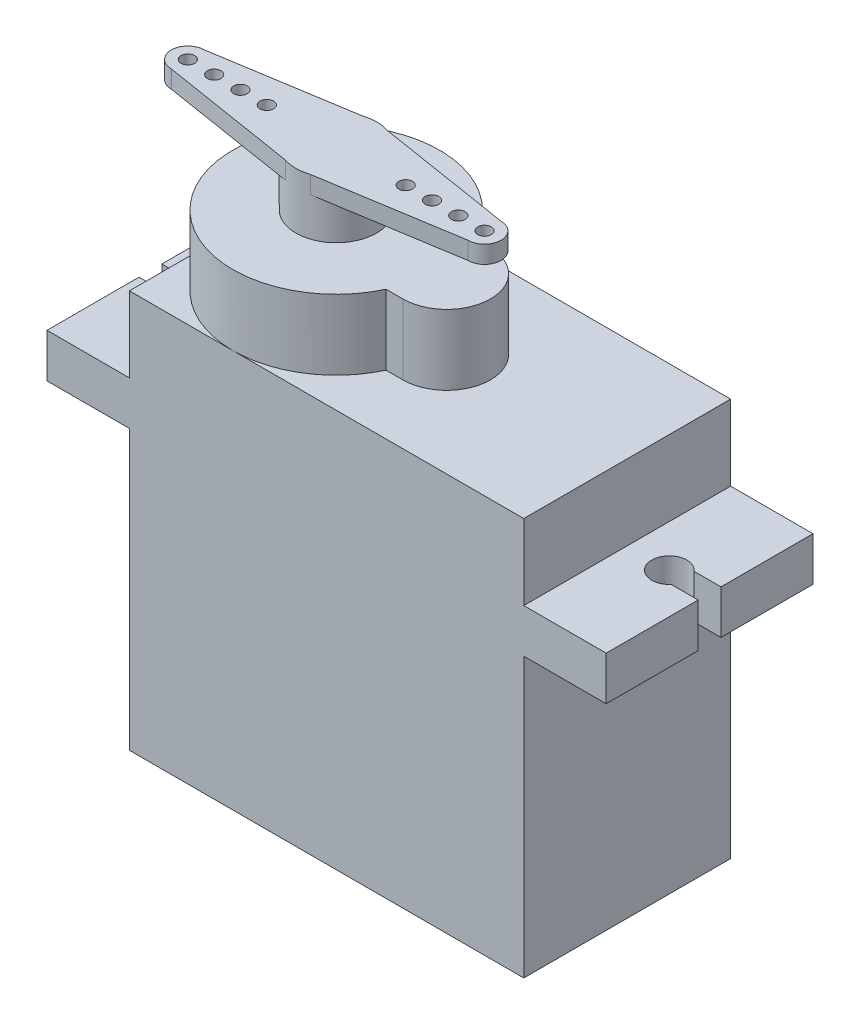
from build123d import *

# Parameters (mm, degrees)
SALIENTE_EXTRUIR1_DEPTH = 11.8
CROQUIS2_R              = 2.3
SALIENTE_EXTRUIR2_DEPTH = 4
CROQUIS3_R              = 2.3
SALIENTE_EXTRUIR3_DEPTH = 7.2
CORTAR_EXTRUIR1_DEPTH   = 7.2
CROQUIS5_R              = 0.38741291
SALIENTE_EXTRUIR4_DEPTH = 1


with BuildPart() as part:
    # Croquis1 → Saliente-Extruir1 (new body)
    with BuildSketch(Plane.XY):
        Polygon((-10.840013315, -12.513302196), (11.659986685, -12.513302196), (11.659986685, 3.386697804), (16.359986685, 3.386697804), (16.359986685, 5.886697804), (11.659986685, 5.886697804), (11.659986685, 10.186697804), (-10.840013315, 10.186697804), (-10.840013315, 5.886697804), (-15.540013315, 5.886697804), (-15.540013315, 3.386697804), (-10.840013315, 3.386697804), align=None)
    extrude(amount=SALIENTE_EXTRUIR1_DEPTH)

    # Croquis2 → Saliente-Extruir2 (add)
    with BuildSketch(Plane(origin=(0, 10.186697804, 0), x_dir=(1, 0, 0), z_dir=(0, 1, 0))):
        with BuildLine():
            Line((1.359986685, -3.4), (0.404142371, -3.4))
            ThreePointArc((0.404142371, -3.4), (-10.840013315, -5.9), (0.404142371, -8.4))
            Line((0.404142371, -8.4), (1.359986685, -8.4))
            ThreePointArc((1.359986685, -8.4), (3.859986685, -5.9), (1.359986685, -3.4))
        make_face()
        with Locations(Location((-4.940013315, -5.9, 0), (0, 0, 270))):
            Circle(CROQUIS2_R, mode=Mode.SUBTRACT)
    extrude(amount=SALIENTE_EXTRUIR2_DEPTH)

    # Croquis3 → Saliente-Extruir3 (add)
    with BuildSketch(Plane(origin=(0, 10.186697804, 0), x_dir=(1, 0, 0), z_dir=(0, 1, 0))):
        with Locations(Location((-4.940013315, -5.9, 0), (0, 0, 270))):
            Circle(CROQUIS3_R)
    extrude(amount=SALIENTE_EXTRUIR3_DEPTH)

    # Croquis4 → Cortar-Extruir1 (cut)
    with BuildSketch(Plane(origin=(0, 5.886697804, 0), x_dir=(1, 0, 0), z_dir=(0, 1, 0))):
        with BuildLine():
            Line((16.359986685, -5.25), (16.359986685, -6.55))
            Line((16.359986685, -6.55), (14.819920893, -6.55))
            ThreePointArc((14.819920893, -6.55), (13.059986685, -5.9), (14.819920893, -5.25))
            Line((14.819920893, -5.25), (16.359986685, -5.25))
        make_face()
        with BuildLine():
            Line((-15.540013315, -6.55), (-15.540013315, -5.25))
            Line((-15.540013315, -5.25), (-13.999947523, -5.25))
            ThreePointArc((-13.999947523, -5.25), (-12.240013315, -5.9), (-13.999947523, -6.55))
            Line((-13.999947523, -6.55), (-15.540013315, -6.55))
        make_face()
    extrude(amount=-CORTAR_EXTRUIR1_DEPTH, mode=Mode.SUBTRACT)

    # Croquis5 → Saliente-Extruir4 (add)
    with BuildSketch(Plane(origin=(0, 17.386697804, 0), x_dir=(1, 0, 0), z_dir=(0, 1, 0))):
        with BuildLine():
            Line((3.522810247, -4.959091344), (-4.940013315, -3.6))
            Line((-4.940013315, -3.6), (-13.402836876, -4.959091344))
            ThreePointArc((-13.402836876, -4.959091344), (-14.343745532, -5.9), (-13.402836876, -6.840908656))
            Line((-13.402836876, -6.840908656), (-4.940013315, -8.2))
            Line((-4.940013315, -8.2), (3.522810247, -6.840908656))
            ThreePointArc((3.522810247, -6.840908656), (4.463718903, -5.9), (3.522810247, -4.959091344))
        make_face()
        with Locations(Location((3.522810247, -5.9, 0), (0, 0, 270))):
            Circle(CROQUIS5_R, mode=Mode.SUBTRACT)
        with Locations(Location((2.022810247, -5.9, 0), (0, 0, 270))):
            Circle(CROQUIS5_R, mode=Mode.SUBTRACT)
        with Locations(Location((0.522810247, -5.9, 0), (0, 0, 270))):
            Circle(CROQUIS5_R, mode=Mode.SUBTRACT)
        with Locations(Location((-0.977189753, -5.9, 0), (0, 0, 270))):
            Circle(CROQUIS5_R, mode=Mode.SUBTRACT)
        with Locations(Location((-13.402836876, -5.9, 0), (0, 0, 270))):
            Circle(CROQUIS5_R, mode=Mode.SUBTRACT)
        with Locations(Location((-11.902836876, -5.9, 0), (0, 0, 270))):
            Circle(CROQUIS5_R, mode=Mode.SUBTRACT)
        with Locations(Location((-10.402836876, -5.9, 0), (0, 0, 270))):
            Circle(CROQUIS5_R, mode=Mode.SUBTRACT)
        with Locations(Location((-8.902836876, -5.9, 0), (0, 0, 270))):
            Circle(CROQUIS5_R, mode=Mode.SUBTRACT)
    extrude(amount=-SALIENTE_EXTRUIR4_DEPTH)


solid = part.part
